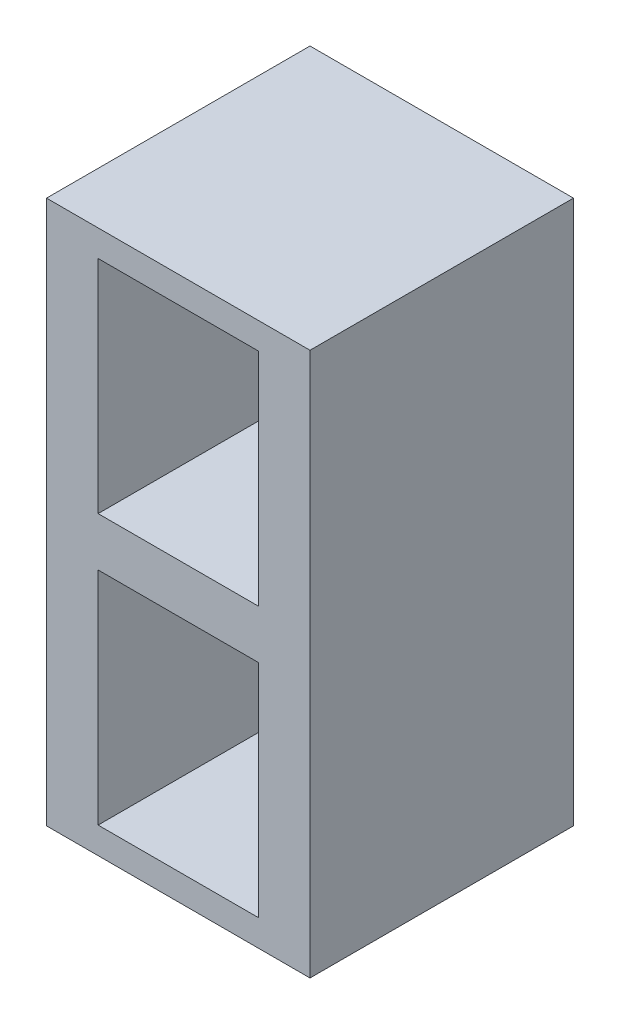
from build123d import *

# Parameters (mm, degrees)
SKETCH1_W           = 189
SKETCH1_H           = 189
BOSS_EXTRUDE1_DEPTH = 390
SKETCH2_W           = 115
SKETCH2_H           = 158.5
CUT_EXTRUDE1_DEPTH  = 444.56651136


with BuildPart() as part:
    # Sketch1 → Boss-Extrude1 (new body)
    with BuildSketch(Plane(origin=(0, 0, 0), x_dir=(1, 0, 0), z_dir=(0, 1, 0))):
        Rectangle(SKETCH1_W, SKETCH1_H)
    extrude(amount=BOSS_EXTRUDE1_DEPTH)

    # Sketch2 → Cut-Extrude1 (cut, through all)
    with BuildSketch(Plane.XY.offset(94.5)):
        with Locations((0, 291.75)):
            Rectangle(SKETCH2_W, SKETCH2_H)
        with Locations((0, 98.25)):
            Rectangle(SKETCH2_W, SKETCH2_H)
    extrude(amount=-CUT_EXTRUDE1_DEPTH, mode=Mode.SUBTRACT)


solid = part.part
